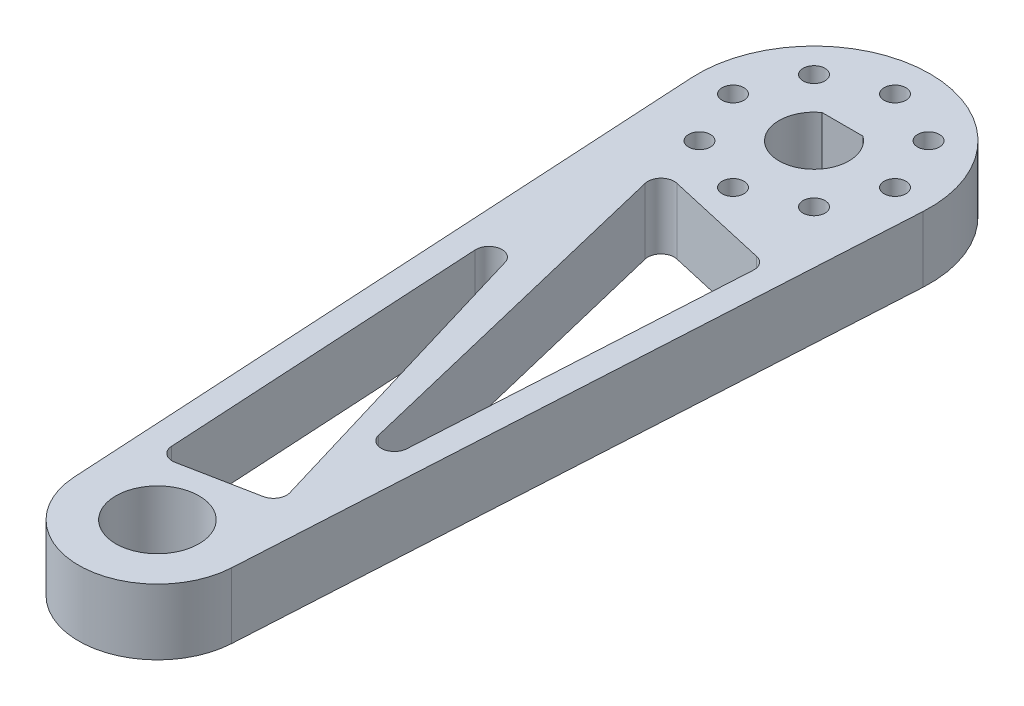
from build123d import *

# Parameters (mm, degrees)
SKETCH_1_R          = 5
EXTRUDE_1_DEPTH     = 15
FILLET_1_R          = 3
SKETCH_2_R          = 2.5
CUT_EXTRUDE_1_DEPTH = 180.107509614
SKETCH_4_R          = 9.5
CUT_EXTRUDE_3_DEPTH = 20


with BuildPart() as part:
    # 草图1 → 凸台-拉伸1 (new body)
    with BuildSketch(Plane(origin=(0, 0, 0), x_dir=(1, 0, 0), z_dir=(0, 1, 0))):
        with BuildLine():
            Line((-17.971076762, -1.02), (-26.457418567, 148.498333333))
            ThreePointArc((-26.457418567, 148.498333333), (0, 176.5), (26.457418567, 148.498333333))
            Line((26.457418567, 148.498333333), (17.971076762, -1.02))
            ThreePointArc((17.971076762, -1.02), (0, -18), (-17.971076762, -1.02))
        make_face()
        with Locations(Location((0, 0, 0), (0, 0, 270))):
            Circle(SKETCH_1_R, mode=Mode.SUBTRACT)
        Polygon((-12.740980954, 12.714849757), (-18.554385191, 115.139490738), (10.712851955, 17.329399023), align=None, mode=Mode.SUBTRACT)
        Polygon((13.283215706, 22.268322657), (18.830257334, 120), (-12, 127), align=None, mode=Mode.SUBTRACT)
        with BuildLine():
            Line((0, 156.5), (4.663689527, 156.5))
            ThreePointArc((4.663689527, 156.5), (0, 142), (-4.663689527, 156.5))
            Line((-4.663689527, 156.5), (0, 156.5))
        make_face(mode=Mode.SUBTRACT)
    extrude(amount=EXTRUDE_1_DEPTH)

    # 圆角1
    fillet_1_edges = [part.edges().sort_by_distance(p)[0] for p in [
        (-12.740980954, 7.5, -12.714849757),
        (10.712851955, 7.5, -17.329399023),
        (-18.554385191, 7.5, -115.139490738),
        (18.830257334, 7.5, -120),
        (-12, 7.5, -127),
        (13.283215706, 7.5, -22.268322657),
    ]]
    fillet(fillet_1_edges, radius=FILLET_1_R)

    # 草图2 → 切除-拉伸1 (cut, through all)
    with BuildSketch(Plane(origin=(0, 15, 0), x_dir=(1, 0, 0), z_dir=(0, 1, 0))):
        with Locations(Location((0, 168.5, 0), (0, 0, 270))):
            Circle(SKETCH_2_R)
        with Locations(Location((13.081475452, 163.081475452, 0), (0, 0, 270))):
            Circle(SKETCH_2_R)
        with Locations(Location((18.5, 150, 0), (0, 0, 270))):
            Circle(SKETCH_2_R)
        with Locations(Location((13.081475452, 136.918524548, 0), (0, 0, 270))):
            Circle(SKETCH_2_R)
        with Locations(Location((0, 131.5, 0), (0, 0, 270))):
            Circle(SKETCH_2_R)
        with Locations(Location((-13.081475452, 136.918524548, 0), (0, 0, 270))):
            Circle(SKETCH_2_R)
        with Locations(Location((-18.5, 150, 0), (0, 0, 270))):
            Circle(SKETCH_2_R)
        with Locations(Location((-13.081475452, 163.081475452, 0), (0, 0, 270))):
            Circle(SKETCH_2_R)
    extrude(amount=-CUT_EXTRUDE_1_DEPTH, mode=Mode.SUBTRACT)

    # 草图4 → 切除-拉伸3 (cut)
    with BuildSketch(Plane.XZ):
        with Locations(Location((0, 0, 0), (0, 0, 270))):
            Circle(SKETCH_4_R)
    extrude(amount=-CUT_EXTRUDE_3_DEPTH, mode=Mode.SUBTRACT)


solid = part.part
